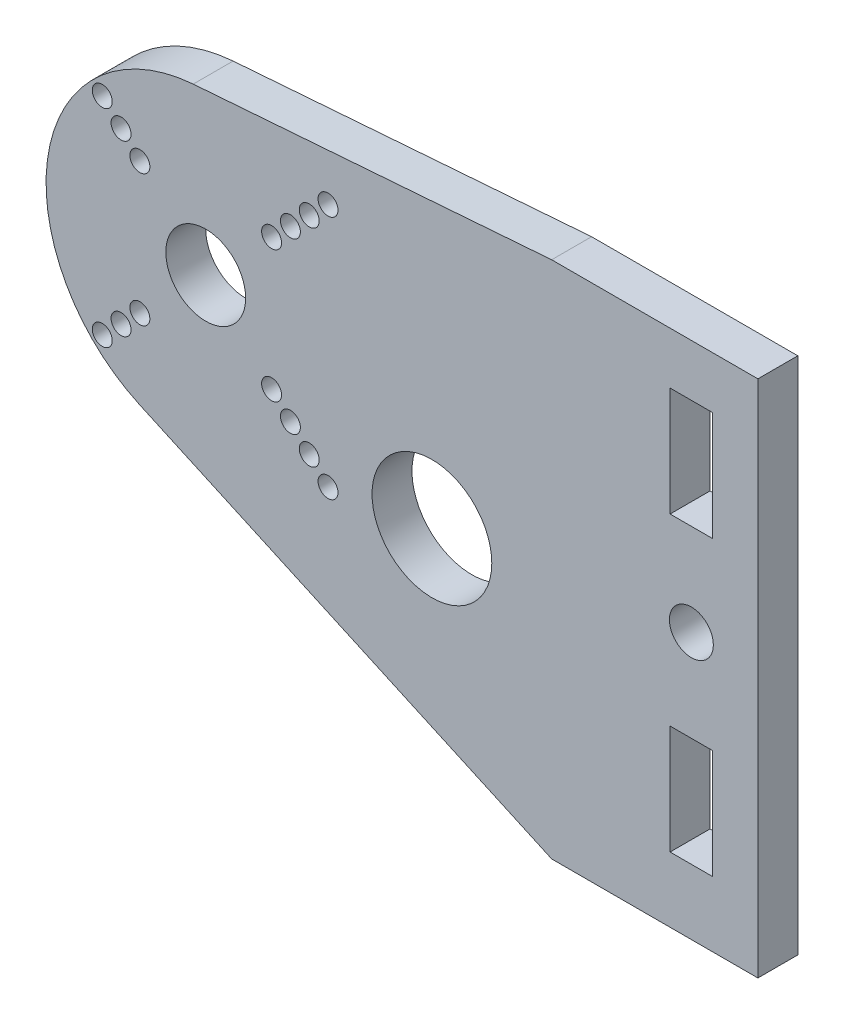
from build123d import *

# Parameters (mm, degrees)
ESKIZ_KONTUR_W        = 3.2
ESKIZ_KONTUR_H        = 8.2
PLASTINA_DEPTH        = 3
OTVERSTIYA_DEPTH      = 49.541218109
OTVERSTIYA_DEPTH_BACK = 49.541218109
ESKIZ_OTVERSTIYA_R    = 0.75
ESKIZ_OTVERSTIYA_R_2  = 4.5
ESKIZ_OTVERSTIYA_R_3  = 3
ESKIZ_OTVERSTIYA_R_4  = 1.65


with BuildPart() as part:
    # Eskiz_kontur → Plastina (new body)
    with BuildSketch(Plane.XY):
        with BuildLine():
            Line((41.499998426, -24.999999723), (25.999998426, -24.999999723))
            Line((25.999998426, -24.999999723), (-4.976321574, -10.919529723))
            ThreePointArc((-4.976321574, -10.919529723), (-11.817691954, 2.083782335), (-0.94151, 11.96301))
            Line((-0.94151, 11.96301), (26, 14))
            Line((26, 14), (41.499998426, 14))
            Line((41.499998426, 14), (41.499998426, -24.999999723))
        make_face()
        with Locations((36.5, -16)):
            Rectangle(ESKIZ_KONTUR_W, ESKIZ_KONTUR_H, mode=Mode.SUBTRACT)
        with Locations((36.5, 6)):
            Rectangle(ESKIZ_KONTUR_W, ESKIZ_KONTUR_H, mode=Mode.SUBTRACT)
    extrude(amount=PLASTINA_DEPTH)

    # Eskiz_otverstiya → Otverstiya (cut, two sides: drawn at the far end of the back side and taken through both)
    with BuildSketch(Plane.XY.offset(-OTVERSTIYA_DEPTH_BACK)):
        with Locations((-7.77817, -7.77817)):
            Circle(ESKIZ_OTVERSTIYA_R)
        with Locations((-6.36396, -6.36396)):
            Circle(ESKIZ_OTVERSTIYA_R)
        with Locations((9.19239, -9.19239)):
            Circle(ESKIZ_OTVERSTIYA_R)
        with Locations((7.77817, -7.77817)):
            Circle(ESKIZ_OTVERSTIYA_R)
        with Locations((6.36396, -6.36396)):
            Circle(ESKIZ_OTVERSTIYA_R)
        with Locations((17, -8)):
            Circle(ESKIZ_OTVERSTIYA_R_2)
        with Locations((-4.94975, -4.94975)):
            Circle(ESKIZ_OTVERSTIYA_R)
        Circle(ESKIZ_OTVERSTIYA_R_3)
        with Locations((4.94975, -4.94975)):
            Circle(ESKIZ_OTVERSTIYA_R)
        with Locations((-4.94975, 4.94975)):
            Circle(ESKIZ_OTVERSTIYA_R)
        with Locations((-6.36396, 6.36396)):
            Circle(ESKIZ_OTVERSTIYA_R)
        with Locations((-7.77817, 7.77817)):
            Circle(ESKIZ_OTVERSTIYA_R)
        with Locations((4.94975, 4.94975)):
            Circle(ESKIZ_OTVERSTIYA_R)
        with Locations((6.36396, 6.36396)):
            Circle(ESKIZ_OTVERSTIYA_R)
        with Locations((7.77817, 7.77817)):
            Circle(ESKIZ_OTVERSTIYA_R)
        with Locations((9.19239, 9.19239)):
            Circle(ESKIZ_OTVERSTIYA_R)
        with Locations((36.5, -5)):
            Circle(ESKIZ_OTVERSTIYA_R_4)
    extrude(amount=OTVERSTIYA_DEPTH + OTVERSTIYA_DEPTH_BACK, mode=Mode.SUBTRACT)


solid = part.part
